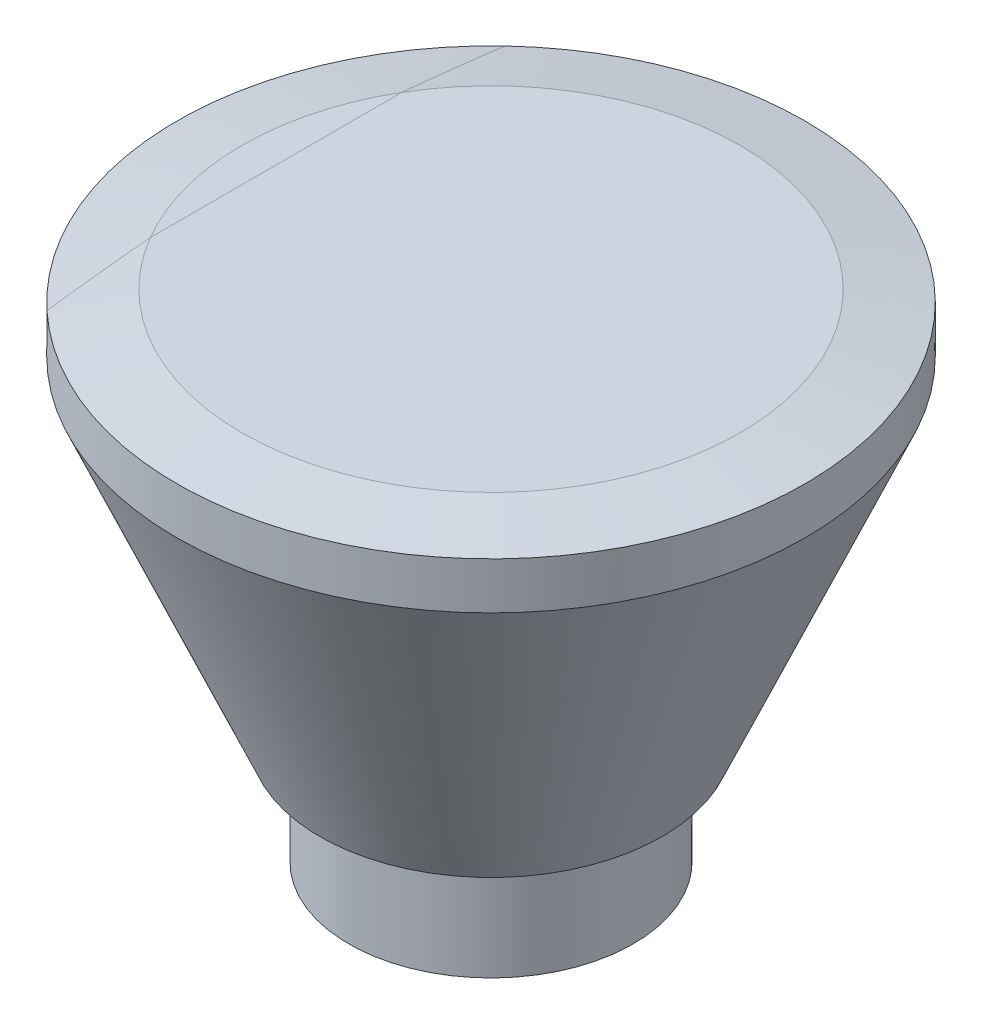
from build123d import *

# Parameters (mm, degrees)
SKETCH3_R          = 3
CUT_EXTRUDE1_DEPTH = 5


with BuildPart() as part:
    # Sketch1 → Revolve1 (revolve)
    with BuildSketch(Plane.XY, mode=Mode.PRIVATE) as revolve1_sk:
        Polygon((-15.060768988, 23.176328976), (-19, 22.481736265), (-19, 19.651328976), (-10.35, -0.323671024), (-8.6, -0.323671024), (-8.6, -6.823671024), (-5.6, -6.823671024), (-5.6, 3.426328976), (-3, 3.426328976), (-3, -1.573671024), (0, -1.573671024), (0, 23.176328976), align=None)
    revolve(revolve1_sk.sketch.rotate(Axis((0, -1.573671024, 0), (0, 1, 0)), 270), axis=Axis((0, -1.573671024, 0), (0, 1, 0)))

    # Sketch3 → Cut-Extrude1 (cut)
    with BuildSketch(Plane.XZ.offset(1.573671024)):
        Circle(SKETCH3_R)
    extrude(amount=-CUT_EXTRUDE1_DEPTH, mode=Mode.SUBTRACT)


solid = part.part
